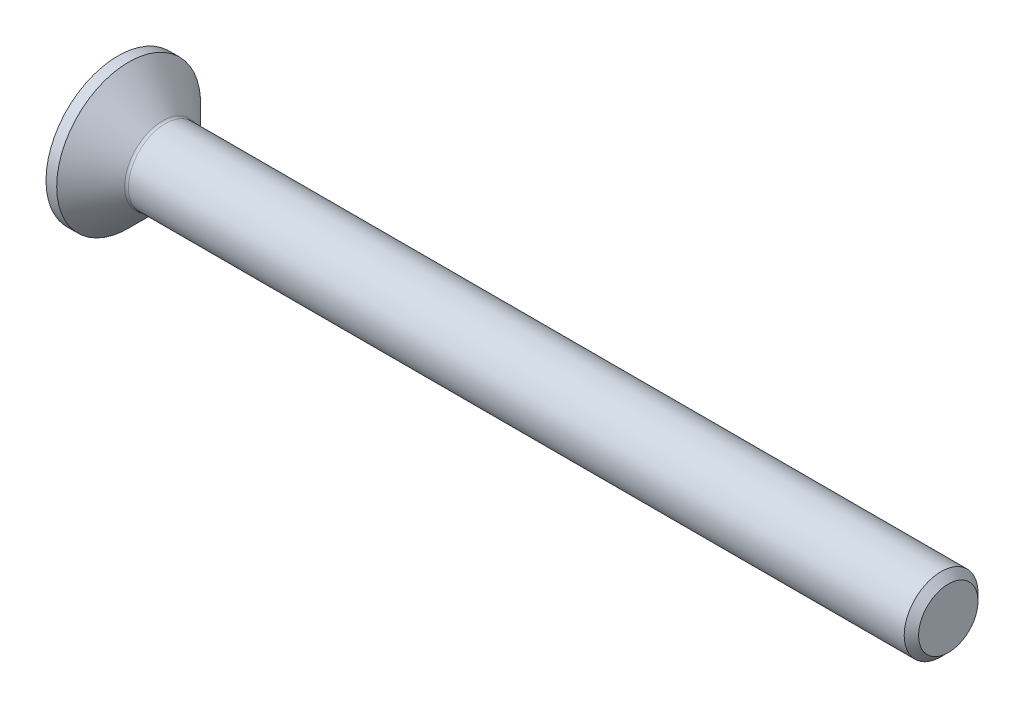
from build123d import *

# Parameters (mm, degrees)
FILLET1_R   = 0.2
HEX_2_DEPTH = 1.5


with BuildPart() as part:
    # BodySke → BaseBody (revolve)
    with BuildSketch(Plane.XY):
        Polygon((0, 0), (0, 3.9), (0.58, 3.9), (2.48, 2), (44.61, 2), (45, 1.61), (45, 0), align=None)
    revolve(axis=Axis((0, 0, 0), (1, 0, 0)))

    # Fillet1
    fillet1_edges = [part.edges().sort_by_distance(p)[0] for p in [
        (2.48, -2, 0),
    ]]
    fillet(fillet1_edges, radius=FILLET1_R)

    # Sketch2 → PreBroach (revolve, cut)
    with BuildSketch(Plane.XY):
        Polygon((0, 1.25), (1.5, 1.25), (2.221687836, 0), (0, 0), align=None)
    revolve(axis=Axis((0, 0, 0), (1, 0, 0)), mode=Mode.SUBTRACT)

    # Sketch3 → Hex 2 (cut)
    with BuildSketch(Plane.ZY):
        Polygon((-1.25, -0.721687836), (-1.25, 0.721687836), (0, 1.443375673), (1.25, 0.721687836), (1.25, -0.721687836), (0, -1.443375673), align=None)
    extrude(amount=-HEX_2_DEPTH, mode=Mode.SUBTRACT)


solid = part.part
